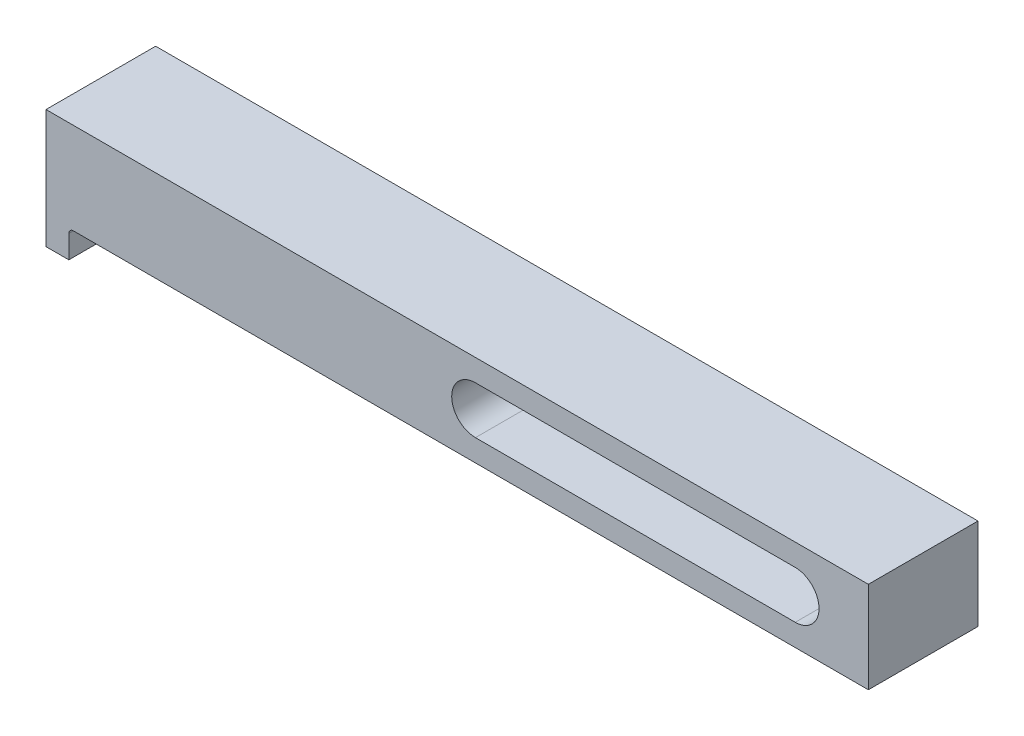
from build123d import *

# Parameters (mm, degrees)
SKETCH_1_W          = 90
SKETCH_1_H          = 10
EXTRUDE_1_DEPTH     = 12
SKETCH_2_W          = 2.5
SKETCH_2_H          = 12
EXTRUDE_2_DEPTH     = 3
CUT_EXTRUDE_1_DEPTH = 92.345497973
FILLET_1_R          = 0.5


with BuildPart() as part:
    # 草图1 → 凸台-拉伸1 (new body)
    with BuildSketch(Plane.XY):
        with Locations((45, 5)):
            Rectangle(SKETCH_1_W, SKETCH_1_H)
    extrude(amount=EXTRUDE_1_DEPTH)

    # 草图2 → 凸台-拉伸2 (add)
    with BuildSketch(Plane.XZ):
        with Locations((1.25, 6)):
            Rectangle(SKETCH_2_W, SKETCH_2_H)
    extrude(amount=EXTRUDE_2_DEPTH)

    # 草图3 → 切除-拉伸1 (cut, through all)
    with BuildSketch(Plane(origin=(0, 0, 0), x_dir=(-1, 0, 0), z_dir=(0, 0, -1))):
        with BuildLine():
            Line((-82, 7.6), (-47, 7.6))
            ThreePointArc((-47, 7.6), (-44.4, 5), (-47, 2.4))
            Line((-47, 2.4), (-82, 2.4))
            ThreePointArc((-82, 2.4), (-84.6, 5), (-82, 7.6))
        make_face()
    extrude(amount=-CUT_EXTRUDE_1_DEPTH, mode=Mode.SUBTRACT)

    # 圆角1
    fillet_1_edges = [part.edges().sort_by_distance(p)[0] for p in [
        (2.5, 0, 6),
    ]]
    fillet(fillet_1_edges, radius=FILLET_1_R)


solid = part.part
